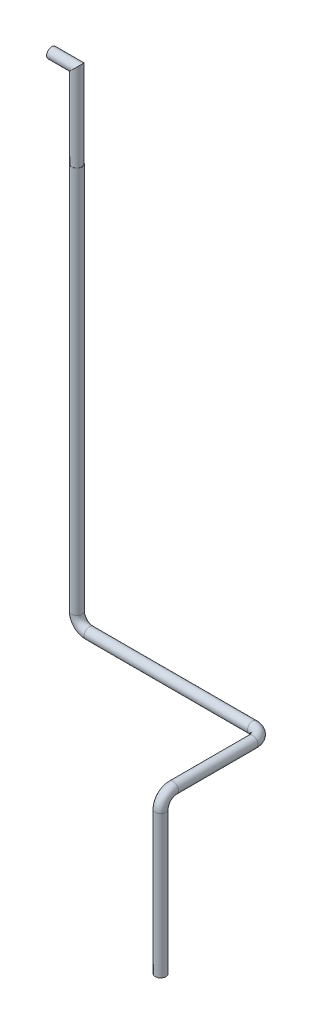
from build123d import *

# Parameters (mm, degrees)
CROQUIS1_R              = 12.7
SALIENTE_EXTRUIR1_DEPTH = 20
CROQUIS2_R              = 12.7
CROQUIS3_R              = 12.25
SALIENTE_EXTRUIR2_DEPTH = 150
CROQUIS4_R              = 12.25


with BuildPart() as part:
    # Croquis1 → Saliente-Extruir1 (new body)
    with BuildSketch(Plane(origin=(0, 0, 0), x_dir=(1, 0, 0), z_dir=(0, 1, 0))):
        with Locations(Location((0, 0, 0), (0, 0, 270))):
            Circle(CROQUIS1_R)
    extrude(amount=SALIENTE_EXTRUIR1_DEPTH)

    # Barrer1: sweep along a curve in space
    with BuildLine() as barrer1_path:
        Line((0, 20, 0), (0, 340, 0))
        ThreePointArc((0, 340, 0), (0, 361.213203436, -8.786796564), (0, 370, -30))
        Line((0, 370, -30), (0, 370, -220))
        ThreePointArc((0, 370, -220), (-8.786796564, 370, -241.213203436), (-30, 370, -250))
        Line((-30, 370, -250), (-420, 370, -250))
        ThreePointArc((-420, 370, -250), (-441.213203436, 378.786796564, -250), (-450, 400, -250))
        Line((-450, 400, -250), (-450, 1325, -250))
    # Croquis2 → Barrer1 (sweep)
    with BuildSketch(Plane(origin=(0, 20, 0), x_dir=(1, 0, 0), z_dir=(0, 1, 0))):
        Circle(CROQUIS2_R)
    sweep(path=barrer1_path.line)

    # Croquis3 → Saliente-Extruir2 (add)
    with BuildSketch(Plane(origin=(0, 1325, 0), x_dir=(1, 0, 0), z_dir=(0, 1, 0))):
        with Locations(Location((-450, 250, 0), (0, 0, 270))):
            Circle(CROQUIS3_R)
    extrude(amount=SALIENTE_EXTRUIR2_DEPTH)

    # Barrer2: sweep along a curve in space
    with BuildLine() as barrer2_path:
        Line((-450, 1475, -250), (-450, 1525, -250))
        Line((-450, 1525, -250), (-510, 1525, -250))
    # Croquis4 → Barrer2 (sweep)
    with BuildSketch(Plane(origin=(0, 1475, 0), x_dir=(1, 0, 0), z_dir=(0, 1, 0))):
        with Locations((-450, 250)):
            Circle(CROQUIS4_R)
    sweep(path=barrer2_path.line, transition=Transition.RIGHT)


solid = part.part
